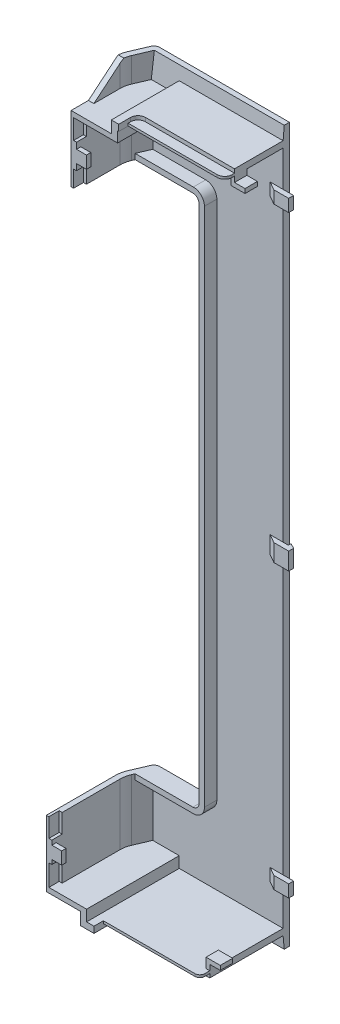
from build123d import *

# Parameters (mm, degrees)
BOSS_EXTRUDE1_DEPTH  = 2.54
BOSS_EXTRUDE2_START  = -288.5
BOSS_EXTRUDE2_DEPTH  = 36.75
BOSS_EXTRUDE3_START  = -36.75
SKETCH4_3_W          = 2.2
SKETCH4_3_H          = 10
BOSS_EXTRUDE3_DEPTH  = 36.75
CUT_EXTRUDE1_DEPTH   = 161.627285976
SKETCH2_W            = 3.357693748
SKETCH2_H            = 2.2
BOSS_EXTRUDE4_DEPTH  = 5
FILLET1_R            = 4.5
FILLET2_R            = 2.5
BOSS_EXTRUDE5_REACH  = 154.276
SKETCH2_3_W          = 3.357693748
SKETCH2_3_H          = 2
BOSS_EXTRUDE6_REACH  = 154.276
CUT_EXTRUDE8_DEPTH   = 293.931412621
FILLET3_R            = 2.5
CUT_EXTRUDE2_DEPTH   = 2.54
CUT_EXTRUDE3_DEPTH   = 1.54
CUT_EXTRUDE4_DEPTH   = 2.54
CUT_EXTRUDE5_DEPTH   = 1.54
SKETCH9_W            = 8.6
SKETCH9_H            = 4.2
SKETCH9_W_2          = 7.6
CUT_EXTRUDE6_DEPTH   = 1.2
SKETCH10_W           = 6.75
SKETCH10_H           = 4
SKETCH10_W_2         = 8
CUT_EXTRUDE7_DEPTH   = 1.2
SKETCH12_W           = 6
SKETCH12_H           = 5
SKETCH12_H_2         = 7
BOSS_EXTRUDE7_DEPTH  = 2
DRAFT1_ANGLE         = 60
SKETCH13_W           = 5
SKETCH13_H           = 1.75
BOSS_EXTRUDE8_DEPTH  = 4
SKETCH14_W           = 4
SKETCH14_H           = 5
BOSS_EXTRUDE9_DEPTH  = 1.5
SKETCH15_W           = 1.75
SKETCH15_H           = 5
BOSS_EXTRUDE10_DEPTH = 4.25
DRAFT2_ANGLE         = 5
DRAFT3_ANGLE         = 5
SKETCH16_W           = 2.125
SKETCH16_H           = 7
BOSS_EXTRUDE11_DEPTH = 1
CHAMFER1_SIZE        = 1
CHAMFER1_SIZE2       = 2
SKETCH17_W           = 0.5
SKETCH17_H           = 10
CUT_EXTRUDE9_DEPTH   = 1


with BuildPart() as part:
    # Sketch1 → Boss-Extrude1 (new body)
    with BuildSketch(Plane(origin=(0, 0, 0), x_dir=(0, 1, 0), z_dir=(0, 0, 1))):
        Polygon((-107.5, 27), (-144.25, 27), (-144.25, -27), (144.25, -27), (144.25, 27), (107.5, 27), (107.5, 2), (-107.5, 2), align=None)
    extrude(amount=BOSS_EXTRUDE1_DEPTH)

    # Sketch4 → Boss-Extrude2 (add)
    with BuildSketch(Plane.XZ.offset(144.25).offset(BOSS_EXTRUDE2_START)):
        with BuildLine():
            Line((-30.446882411, 8.073506155), (-27.715620382, 1.676171354))
            Line((-27.715620382, 1.676171354), (-27, 1.98169652))
            Line((-27, 1.98169652), (-27, 2.54))
            Line((-27, 2.54), (-25.692306252, 2.54))
            Line((-25.692306252, 2.54), (-28.246882411, 8.523489974))
            ThreePointArc((-28.246882411, 8.523489974), (-28.84716347, 10.446090622), (-29.05, 12.449983819))
            Line((-29.05, 12.449983819), (-29.05, 30))
            Line((-29.05, 30), (-31.25, 30))
            Line((-31.25, 30), (-31.25, 12))
            ThreePointArc((-31.25, 12), (-31.04716347, 9.996106803), (-30.446882411, 8.073506155))
        make_face()
        Polygon((-27.715620382, 1.676171354), (-27, 0), (-27, 1.98169652), align=None)
    extrude(amount=BOSS_EXTRUDE2_DEPTH)

    # Sketch4<3> → Boss-Extrude3 (add)
    with BuildSketch(Plane.XZ.offset(144.25).offset(BOSS_EXTRUDE3_START)):
        with BuildLine():
            Line((-30.446882411, 8.073506155), (-27.715620382, 1.676171354))
            Line((-27.715620382, 1.676171354), (-27, 1.98169652))
            Line((-27, 1.98169652), (-27, 2.54))
            Line((-27, 2.54), (-25.692306252, 2.54))
            Line((-25.692306252, 2.54), (-28.246882411, 8.523489974))
            ThreePointArc((-28.246882411, 8.523489974), (-28.84716347, 10.446090622), (-29.05, 12.449983819))
            Line((-29.05, 12.449983819), (-29.05, 30))
            Line((-29.05, 30), (-31.25, 30))
            Line((-31.25, 30), (-31.25, 12))
            ThreePointArc((-31.25, 12), (-31.04716347, 9.996106803), (-30.446882411, 8.073506155))
        make_face()
        with Locations((-30.15, 35)):
            Rectangle(SKETCH4_3_W, SKETCH4_3_H)
        Polygon((-27.715620382, 1.676171354), (-27, 0), (-27, 1.98169652), align=None)
    extrude(amount=BOSS_EXTRUDE3_DEPTH)

    # Sketch5 → Cut-Extrude1 (cut, through all)
    with BuildSketch(Plane(origin=(-31.25, 0, 0), x_dir=(0, -1, 0), z_dir=(-1, 0, 0))):
        Polygon((-134.25, 30), (-134.25, 23), (-144.25, 11), (-144.25, 30), align=None)
        Polygon((144.25, 11), (134.25, 23), (134.25, 40), (144.25, 40), align=None)
    extrude(amount=-CUT_EXTRUDE1_DEPTH, mode=Mode.SUBTRACT)

    # Sketch2 → Boss-Extrude4 (add)
    with BuildSketch(Plane.XY.offset(2.54)):
        Polygon((0.2, 109.7), (-25.692306252, 109.7), (-25.692306252, 107.5), (-2, 107.5), (-2, -107.5), (-25.692306252, -107.5), (-25.692306252, -109.7), (0.2, -109.7), align=None)
        with Locations((-27.371153126, -108.6)):
            Rectangle(SKETCH2_W, SKETCH2_H)
        with Locations((-27.371153126, 108.6)):
            Rectangle(SKETCH2_W, SKETCH2_H)
    extrude(amount=BOSS_EXTRUDE4_DEPTH)

    # Fillet1
    fillet1_edges = [part.edges().sort_by_distance(p)[0] for p in [
        (0.2, 109.7, 5.04),
        (0.2, -109.7, 5.04),
    ]]
    fillet(fillet1_edges, radius=FILLET1_R)

    # Fillet2
    fillet2_edges = [part.edges().sort_by_distance(p)[0] for p in [
        (-2, -107.5, 3.77),
        (-2, 107.5, 3.77),
    ]]
    fillet(fillet2_edges, radius=FILLET2_R)

    # Boss-Extrude5: up to this face of the body (flat: up to its plane)
    boss_extrude5_end = Plane(part.part.faces().sort_by_distance((-30.15, -120.875, 40))[0])
    # Sketch2<3> → Boss-Extrude5 (add, up to the picked face)
    with BuildSketch(Plane.XY.offset(2.54), mode=Mode.PRIVATE) as boss_extrude5_sk1:
        Polygon((27, -139.25), (27, -136.71), (-15, -136.71), (-15, -132.25), (-25.692306252, -132.25), (-25.692306252, -134.25), (-17.54, -134.25), (-17.54, -139.25), align=None)
    boss_extrude5_tool1 = split(extrude(boss_extrude5_sk1.sketch, amount=BOSS_EXTRUDE5_REACH, mode=Mode.PRIVATE), bisect_by=boss_extrude5_end, keep=Keep.BOTH, mode=Mode.PRIVATE)
    # Sketch2<3> → Boss-Extrude5 (add, up to the picked face)
    with BuildSketch(Plane.XY.offset(2.54), mode=Mode.PRIVATE) as boss_extrude5_sk2:
        with Locations((-27.371153126, -133.25)):
            Rectangle(SKETCH2_3_W, SKETCH2_3_H)
    boss_extrude5_tool2 = split(extrude(boss_extrude5_sk2.sketch, amount=BOSS_EXTRUDE5_REACH, mode=Mode.PRIVATE), bisect_by=boss_extrude5_end, keep=Keep.BOTH, mode=Mode.PRIVATE)
    add(boss_extrude5_tool1.solids().sort_by(Axis((-0.011676, -137.150458, 2.54), (0, 0, 1)))[0])
    add(boss_extrude5_tool2.solids().sort_by(Axis((-27.371153, -133.25, 2.54), (0, 0, 1)))[0])

    # Boss-Extrude6: up to this face of the body (flat: up to its plane)
    boss_extrude6_end = Plane(part.part.faces().sort_by_distance((-30.15, 120.875, 30))[0])
    # Sketch2<4> → Boss-Extrude6 (add, up to the picked face)
    with BuildSketch(Plane.XY.offset(2.54), mode=Mode.PRIVATE) as boss_extrude6_sk1:
        Polygon((-29.05, 134.25), (-15, 134.25), (-15, 139.05), (27, 139.05), (27, 136.51), (-12.46, 136.51), (-12.46, 132.25), (-29.05, 132.25), align=None)
    boss_extrude6_tool1 = split(extrude(boss_extrude6_sk1.sketch, amount=BOSS_EXTRUDE6_REACH, mode=Mode.PRIVATE), bisect_by=boss_extrude6_end, keep=Keep.BOTH, mode=Mode.PRIVATE)
    add(boss_extrude6_tool1.solids().sort_by(Axis((-0.874906, 136.653064, 2.54), (0, 0, 1)))[0])

    # Sketch11 → Cut-Extrude8 (cut, through all)
    with BuildSketch(Plane.XZ.offset(144.25)):
        Polygon((-27, 0), (-30.446882411, 8.073506155), (-30.446882411, 0), align=None)
    extrude(amount=-CUT_EXTRUDE8_DEPTH, mode=Mode.SUBTRACT)

    # Fillet3
    fillet3_edges = [part.edges().sort_by_distance(p)[0] for p in [
        (-27, 125.875, 0),
        (-27, -125.875, 0),
    ]]
    fillet(fillet3_edges, radius=FILLET3_R)

    # Sketch7 → Cut-Extrude2 (cut)
    with BuildSketch(Plane.XZ.offset(139.25)):
        with BuildLine():
            ThreePointArc((25, 36.2), (26.414213562, 35.614213562), (27, 34.2))
            Line((27, 34.2), (27, 36.2))
            Line((27, 36.2), (27, 40))
            Line((27, 40), (-12, 40))
            Line((-12, 40), (-12, 36.2))
            Line((-12, 36.2), (25, 36.2))
        make_face()
    extrude(amount=-CUT_EXTRUDE2_DEPTH, mode=Mode.SUBTRACT)

    # Sketch7<3> → Cut-Extrude3 (cut)
    with BuildSketch(Plane.XZ.offset(139.25)):
        with BuildLine():
            Line((-10, 32.2), (27, 32.2))
            Line((27, 32.2), (27, 34.2))
            ThreePointArc((27, 34.2), (26.414213562, 35.614213562), (25, 36.2))
            Line((25, 36.2), (-12, 36.2))
            Line((-12, 36.2), (-12, 34.2))
            ThreePointArc((-12, 34.2), (-11.414213562, 32.785786438), (-10, 32.2))
        make_face()
    extrude(amount=-CUT_EXTRUDE3_DEPTH, mode=Mode.SUBTRACT)

    # Sketch8 → Cut-Extrude4 (cut)
    with BuildSketch(Plane(origin=(0, 139.05, 0), x_dir=(-1, 0, 0), z_dir=(0, 1, 0))):
        with BuildLine():
            Line((12, 26.2), (12, 30))
            Line((12, 30), (-27, 30))
            Line((-27, 30), (-27, 23.2))
            ThreePointArc((-27, 23.2), (-26.121320344, 25.321320344), (-24, 26.2))
            Line((-24, 26.2), (12, 26.2))
        make_face()
    extrude(amount=-CUT_EXTRUDE4_DEPTH, mode=Mode.SUBTRACT)

    # Sketch8<3> → Cut-Extrude5 (cut)
    with BuildSketch(Plane(origin=(0, 139.05, 0), x_dir=(-1, 0, 0), z_dir=(0, 1, 0))):
        with BuildLine():
            Line((12, 25.2), (12, 26.2))
            Line((12, 26.2), (-24, 26.2))
            ThreePointArc((-24, 26.2), (-26.121320344, 25.321320344), (-27, 23.2))
            Line((-27, 23.2), (-27, 22.2))
            Line((-27, 22.2), (9, 22.2))
            ThreePointArc((9, 22.2), (11.121320344, 23.078679656), (12, 25.2))
        make_face()
    extrude(amount=-CUT_EXTRUDE5_DEPTH, mode=Mode.SUBTRACT)

    # Sketch9 → Cut-Extrude6 (cut)
    with BuildSketch(Plane.YZ.offset(-29.05)):
        with Locations((-127.95, 37.9)):
            Rectangle(SKETCH9_W, SKETCH9_H)
        with Locations((-111.3, 37.9)):
            Rectangle(SKETCH9_W_2, SKETCH9_H)
    extrude(amount=-CUT_EXTRUDE6_DEPTH, mode=Mode.SUBTRACT)

    # Sketch10 → Cut-Extrude7 (cut)
    with BuildSketch(Plane.YZ.offset(-29.05)):
        with Locations((110.875, 28)):
            Rectangle(SKETCH10_W, SKETCH10_H)
        with Locations((128.25, 28)):
            Rectangle(SKETCH10_W_2, SKETCH10_H)
    extrude(amount=-CUT_EXTRUDE7_DEPTH, mode=Mode.SUBTRACT)

    # Sketch12 → Boss-Extrude7 (add)
    with BuildSketch(Plane.XY.offset(2.54)):
        with Locations((28.25, -120.5)):
            Rectangle(SKETCH12_W, SKETCH12_H)
        with Locations((28.25, -5)):
            Rectangle(SKETCH12_W, SKETCH12_H_2)
        with Locations((28.25, 119.5)):
            Rectangle(SKETCH12_W, SKETCH12_H)
    extrude(amount=BOSS_EXTRUDE7_DEPTH)

    # Draft1
    draft1_faces = [part.faces().sort_by_distance(p)[0] for p in [
        (25.25, -120.5, 3.54),
        (25.25, -5, 3.54),
        (25.25, 119.5, 3.54),
    ]]
    draft(draft1_faces, Plane.XY.offset(4.54), DRAFT1_ANGLE)

    # Sketch13 → Boss-Extrude8 (add)
    with BuildSketch(Plane.YZ.offset(-29.05)):
        with Locations((-119.375, 39.125)):
            Rectangle(SKETCH13_W, SKETCH13_H)
        with Locations((119.25, 29.125)):
            Rectangle(SKETCH13_W, SKETCH13_H)
    extrude(amount=BOSS_EXTRUDE8_DEPTH)

    # Sketch14 → Boss-Extrude9 (add)
    with BuildSketch(Plane.YZ.offset(25.5)):
        with Locations((134.51, 19.7)):
            Rectangle(SKETCH14_W, SKETCH14_H)
        with Locations((-134.71, 29.7)):
            Rectangle(SKETCH14_W, SKETCH14_H)
    extrude(amount=BOSS_EXTRUDE9_DEPTH)

    # Sketch15 → Boss-Extrude10 (add)
    with BuildSketch(Plane.YZ.offset(27)):
        with Locations((-133.585, 29.7)):
            Rectangle(SKETCH15_W, SKETCH15_H)
        with Locations((133.385, 19.7)):
            Rectangle(SKETCH15_W, SKETCH15_H)
    extrude(amount=BOSS_EXTRUDE10_DEPTH)

    # Draft2
    draft2_faces = [part.faces().sort_by_distance(p)[0] for p in [
        (-2.659119817, 140.861198407, 2.54),
    ]]
    draft(draft2_faces, Plane(origin=(0, 139.05, 86.460982103), x_dir=(0, 0, 1), z_dir=(0, 1, 0)), DRAFT2_ANGLE)

    # Draft3
    draft3_faces = [part.faces().sort_by_distance(p)[0] for p in [
        (-2.330014026, -141.080071643, 2.54),
    ]]
    draft(draft3_faces, Plane(origin=(0, -139.25, 96.485418472), x_dir=(0, 0, -1), z_dir=(0, -1, 0)), DRAFT3_ANGLE)

    # Sketch16 → Boss-Extrude11 (add)
    with BuildSketch(Plane(origin=(0, 0, 2.54), x_dir=(1, 0, 0), z_dir=(0, 0, -1))):
        with Locations((30.1875, 5)):
            Rectangle(SKETCH16_W, SKETCH16_H)
    extrude(amount=BOSS_EXTRUDE11_DEPTH)

    # Chamfer1
    chamfer1_edges = [part.edges().sort_by_distance(p)[0] for p in [
        (31.25, -5, 1.54),
    ]]
    chamfer1_side = [part.faces().sort_by_distance(p)[0] for p in [
        (31.25, -5, 3.04),
    ]]
    chamfer(chamfer1_edges, length=CHAMFER1_SIZE, length2=CHAMFER1_SIZE2, reference=chamfer1_side[0])

    # Sketch17 → Cut-Extrude9 (cut)
    with BuildSketch(Plane(origin=(0, 0, 0), x_dir=(1, 0, 0), z_dir=(0, 0, -1))):
        Polygon((18, 0), (19.8, -5), (19.8, 5), align=None)
        with Locations((21.25, 0)):
            Rectangle(SKETCH17_W, SKETCH17_H)
        with Locations((22.75, 0)):
            Rectangle(SKETCH17_W, SKETCH17_H)
    extrude(amount=-CUT_EXTRUDE9_DEPTH, mode=Mode.SUBTRACT)


solid = part.part
